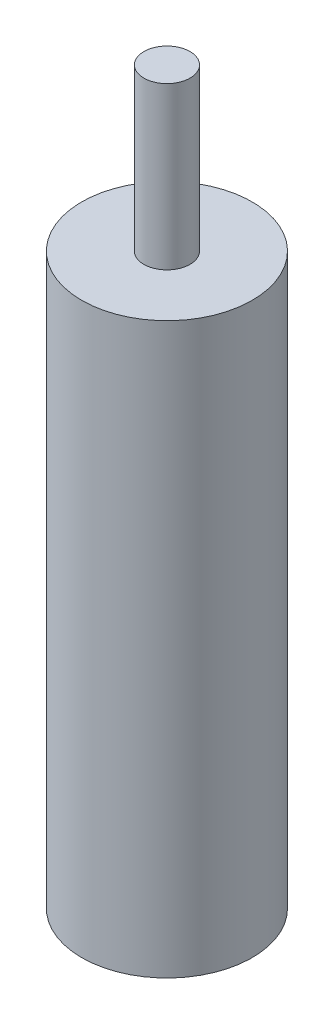
from build123d import *

# Parameters (mm, degrees)
SKETCH1_R           = 18.5
BOSS_EXTRUDE1_DEPTH = 123.5
SKETCH2_R           = 5
BOSS_EXTRUDE2_DEPTH = 35


with BuildPart() as part:
    # Sketch1 → Boss-Extrude1 (new body)
    with BuildSketch(Plane(origin=(0, 0, 0), x_dir=(1, 0, 0), z_dir=(0, 1, 0))):
        with Locations(Location((0, 0, 0), (0, 0, 270))):
            Circle(SKETCH1_R)
    extrude(amount=BOSS_EXTRUDE1_DEPTH)

    # Sketch2 → Boss-Extrude2 (add)
    with BuildSketch(Plane(origin=(0, 123.5, 0), x_dir=(1, 0, 0), z_dir=(0, 1, 0))):
        with Locations(Location((0, 0, 0), (0, 0, 270))):
            Circle(SKETCH2_R)
    extrude(amount=BOSS_EXTRUDE2_DEPTH)


solid = part.part
